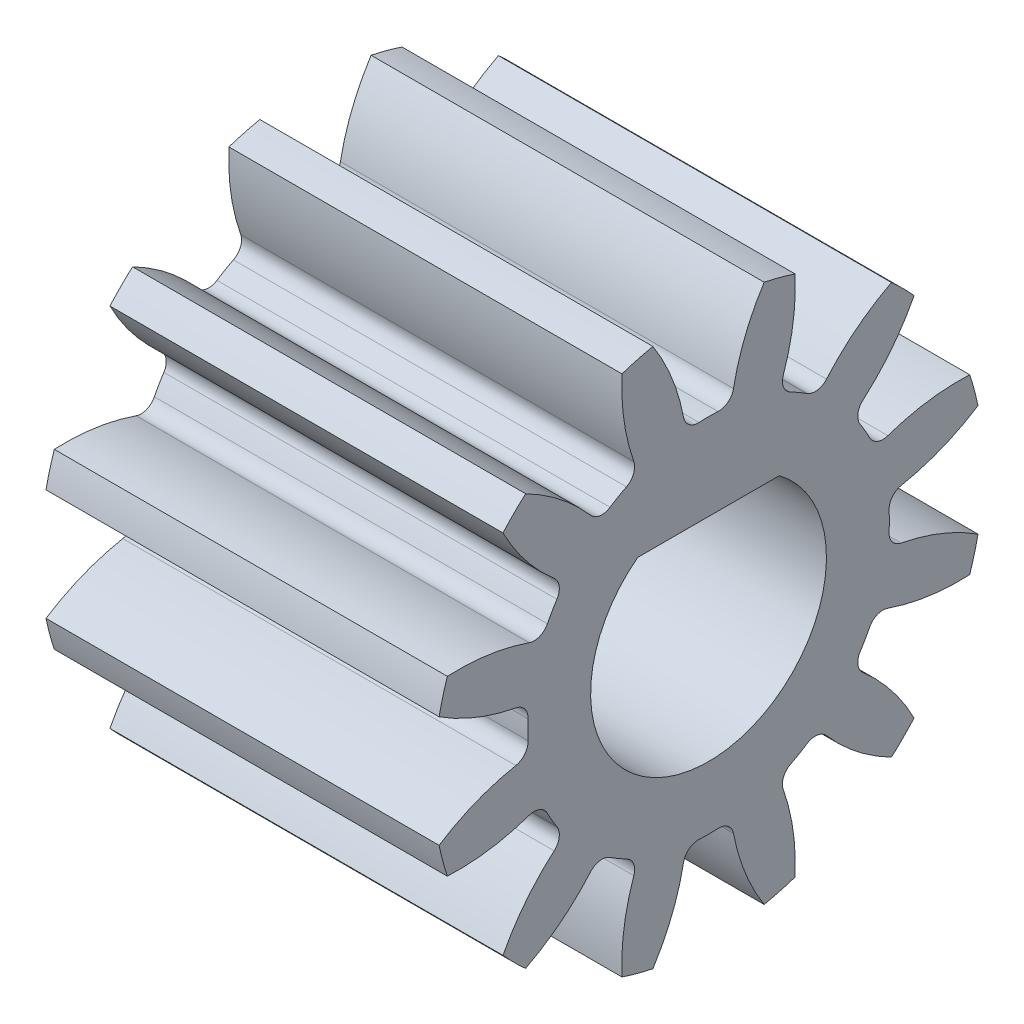
from build123d import *

# Parameters (mm, degrees)
SKETCH1_R                = 7
SKETCH1_R_2              = 3
BOSS_EXTRUDE2_DEPTH      = 10
CUT_EXTRUDE1_DEPTH       = 15.071247279
FILLET1_R                = 0.38
CIRPATTERN2_COUNT        = 12
FILLET1_OF_CIRPATTERN2_R = 0.38
BOSS_EXTRUDE3_DEPTH      = 10


with BuildPart() as part:
    # Sketch1 → Boss-Extrude2 (new body)
    with BuildSketch(Plane(origin=(0, 0, 0), x_dir=(0, 0, -1), z_dir=(1, 0, 0))):
        Circle(SKETCH1_R)
        Circle(SKETCH1_R_2, mode=Mode.SUBTRACT)
    extrude(amount=BOSS_EXTRUDE2_DEPTH)

    # Sketch3 → Cut-Extrude1 (cut, through all)
    with BuildSketch(Plane(origin=(10, 0, 0), x_dir=(0, 0, -1), z_dir=(1, 0, 0))):
        with BuildLine():
            ThreePointArc((0.580885946, 4.563175596), (0, 4.6), (-0.580885946, 4.563175596))
            ThreePointArc((-0.580885946, 4.563175596), (-0.87003937, 5.755903257), (-1.415205558, 6.855449892))
            ThreePointArc((-1.415205558, 6.855449892), (0, 7), (1.415205558, 6.855449892))
            ThreePointArc((1.415205558, 6.855449892), (0.87003937, 5.755903257), (0.580885946, 4.563175596))
        make_face()
    cut_extrude1 = extrude(amount=-CUT_EXTRUDE1_DEPTH, mode=Mode.SUBTRACT)

    # Fillet1
    fillet1_edges = [part.edges().sort_by_distance(p)[0] for p in [
        (5, 4.563175596, 0.580885946),
        (5, 4.563175596, -0.580885946),
    ]]
    fillet(fillet1_edges, radius=FILLET1_R)

    # CirPattern2: Cut-Extrude1 ×12 about axis
    cirpattern2_axis = Axis((0, 0, 0), (1, 0, 0))
    for i in range(1, CIRPATTERN2_COUNT):
        add(cut_extrude1.rotate(cirpattern2_axis, i * 360 / CIRPATTERN2_COUNT), mode=Mode.SUBTRACT)

    # Fillet1 of CirPattern2
    fillet1_of_cirpattern2_edges = [part.edges().sort_by_distance(p)[0] for p in [
        (5, 3.661383015, 2.784649784),
        (5, 4.242268961, 1.778525812),
        (5, 1.778525812, 4.242268961),
        (5, 2.784649784, 3.661383015),
        (5, -0.580885946, 4.563175596),
        (5, 0.580885946, 4.563175596),
        (5, -2.784649784, 3.661383015),
        (5, -1.778525812, 4.242268961),
        (5, -4.242268961, 1.778525812),
        (5, -3.661383015, 2.784649784),
        (5, -4.563175596, -0.580885946),
        (5, -4.563175596, 0.580885946),
        (5, -3.661383015, -2.784649784),
        (5, -4.242268961, -1.778525812),
        (5, -1.778525812, -4.242268961),
        (5, -2.784649784, -3.661383015),
        (5, 0.580885946, -4.563175596),
        (5, -0.580885946, -4.563175596),
        (5, 2.784649784, -3.661383015),
        (5, 1.778525812, -4.242268961),
        (5, 4.242268961, -1.778525812),
        (5, 3.661383015, -2.784649784),
    ]]
    fillet(fillet1_of_cirpattern2_edges, radius=FILLET1_OF_CIRPATTERN2_R)

    # Sketch4 → Boss-Extrude3 (add)
    with BuildSketch(Plane.ZY):
        with BuildLine():
            Line((-1.8, 2.4), (1.8, 2.4))
            ThreePointArc((1.8, 2.4), (0, 3), (-1.8, 2.4))
        make_face()
    extrude(amount=-BOSS_EXTRUDE3_DEPTH)


solid = part.part
